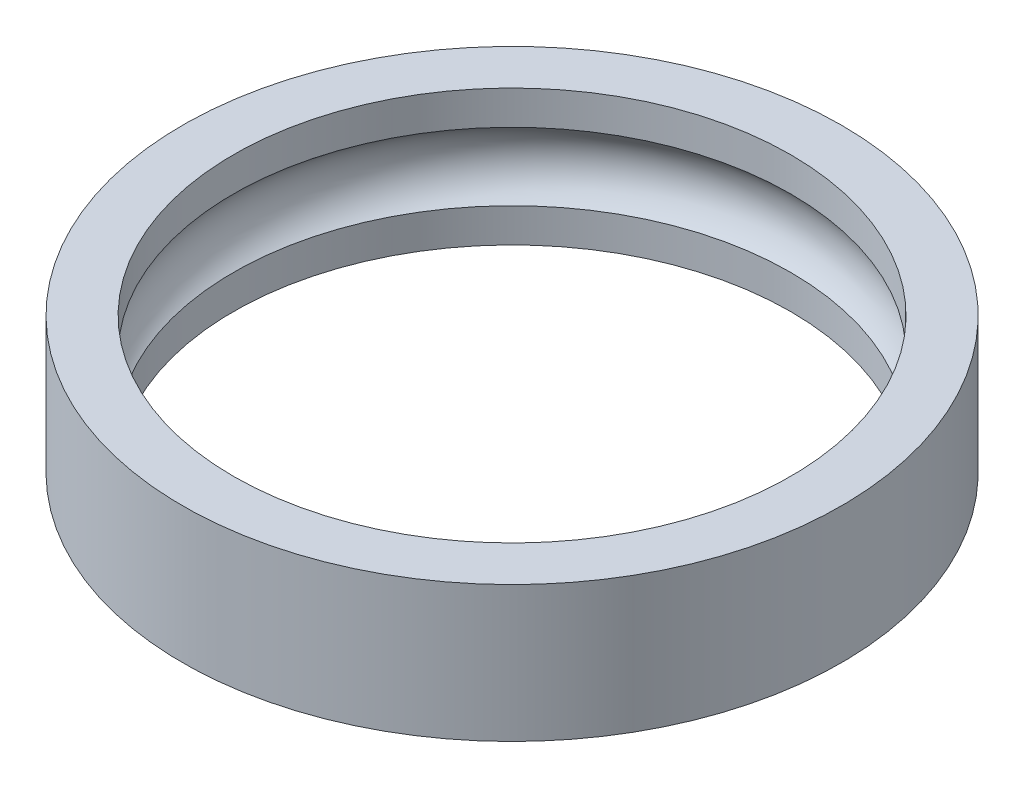
from build123d import *


with BuildPart() as part:
    # Sketch3 → Revolve3 (revolve)
    with BuildSketch(Plane.XY, mode=Mode.PRIVATE) as revolve3_sk:
        with BuildLine():
            Line((26.035, 0), (30.7975, 0))
            Line((30.7975, 0), (30.7975, 12.7))
            Line((30.7975, 12.7), (26.035, 12.7))
            Line((26.035, 12.7), (26.035, 9.525))
            ThreePointArc((26.035, 9.525), (27.6225, 6.35), (26.035, 3.175))
            Line((26.035, 3.175), (26.035, 0))
        make_face()
    revolve(revolve3_sk.sketch.rotate(Axis((0, 0, 0), (0, 1, 0)), 90), axis=Axis((0, 0, 0), (0, 1, 0)))


solid = part.part
